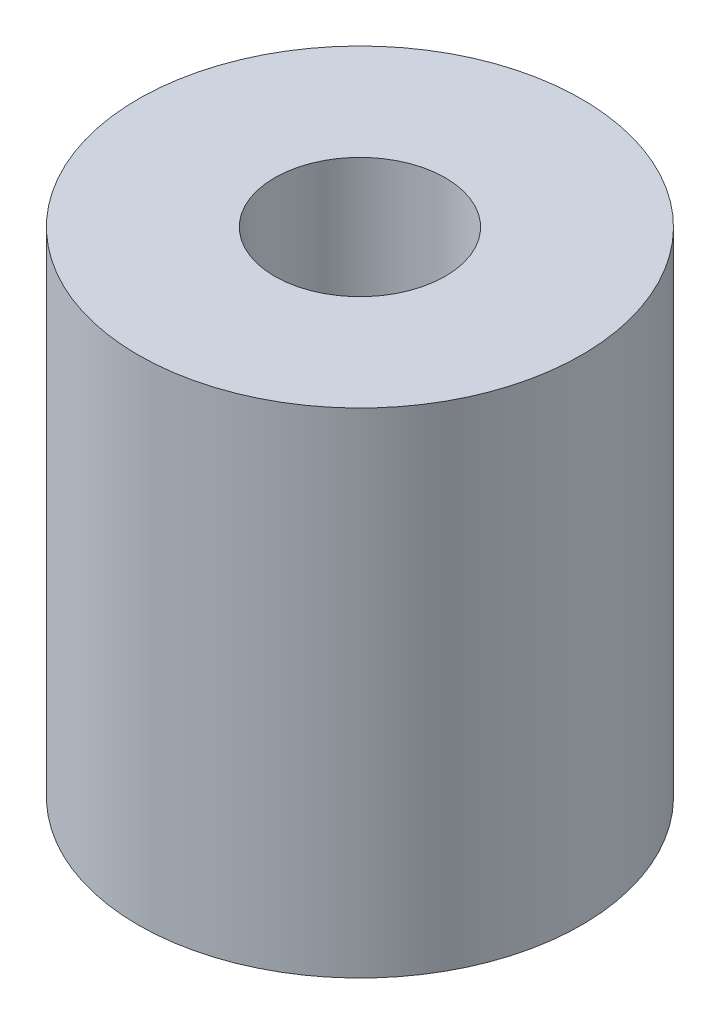
from build123d import *

# Parameters (mm, degrees)
SKETCH1_R           = 5
SKETCH1_R_2         = 1.575
BOSS_EXTRUDE1_DEPTH = 11.132
SKETCH2_R           = 1.925
CUT_EXTRUDE1_DEPTH  = 4


with BuildPart() as part:
    # Sketch1 → Boss-Extrude1 (new body)
    with BuildSketch(Plane(origin=(0, 0, 0), x_dir=(1, 0, 0), z_dir=(0, 1, 0))):
        with Locations(Location((0, 0, 0), (0, 0, 270))):
            Circle(SKETCH1_R)
        with Locations(Location((0, 0, 0), (0, 0, 270))):
            Circle(SKETCH1_R_2, mode=Mode.SUBTRACT)
    extrude(amount=BOSS_EXTRUDE1_DEPTH)

    # Sketch2 → Cut-Extrude1 (cut)
    with BuildSketch(Plane(origin=(0, 11.132, 0), x_dir=(1, 0, 0), z_dir=(0, 1, 0))):
        with Locations(Location((0, 0, 0), (0, 0, 270))):
            Circle(SKETCH2_R)
    extrude(amount=-CUT_EXTRUDE1_DEPTH, mode=Mode.SUBTRACT)


solid = part.part
